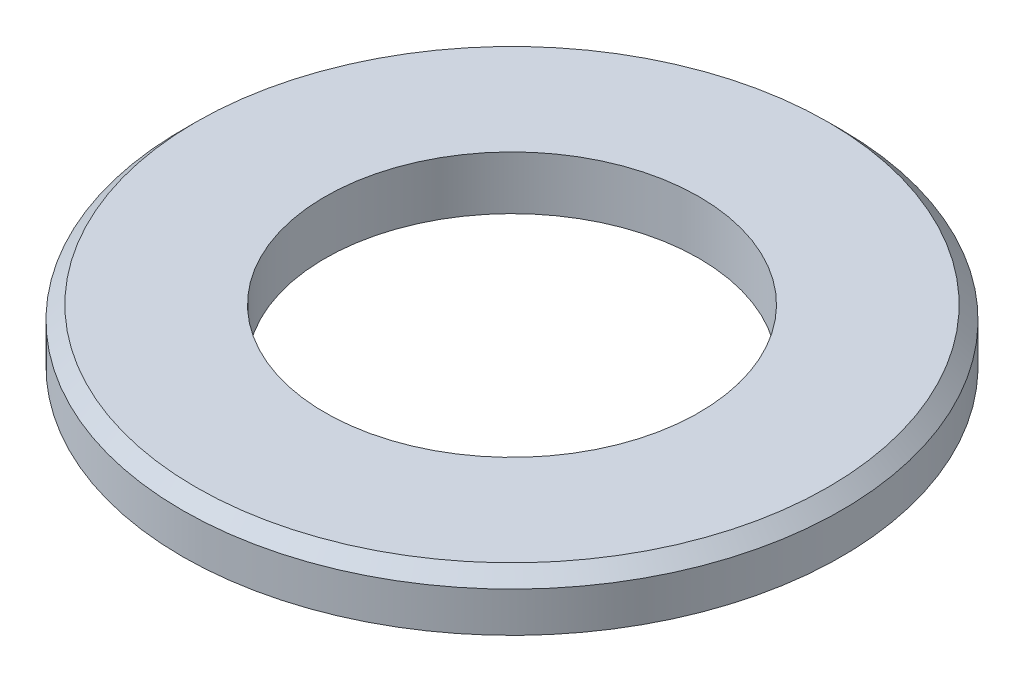
from build123d import *


with BuildPart() as part:
    # 草图1 → Revolve 484 (revolve)
    with BuildSketch(Plane.XY, mode=Mode.PRIVATE) as revolve_484_sk:
        Polygon((-17.75, 11.644507042), (-18.5, 10.894507042), (-18.5, 8.644507042), (-10.5, 8.644507042), (-10.5, 11.644507042), align=None)
    revolve(revolve_484_sk.sketch.rotate(Axis((0, 0, 0), (0, 1, 0)), 270), axis=Axis((0, 0, 0), (0, 1, 0)))


solid = part.part
